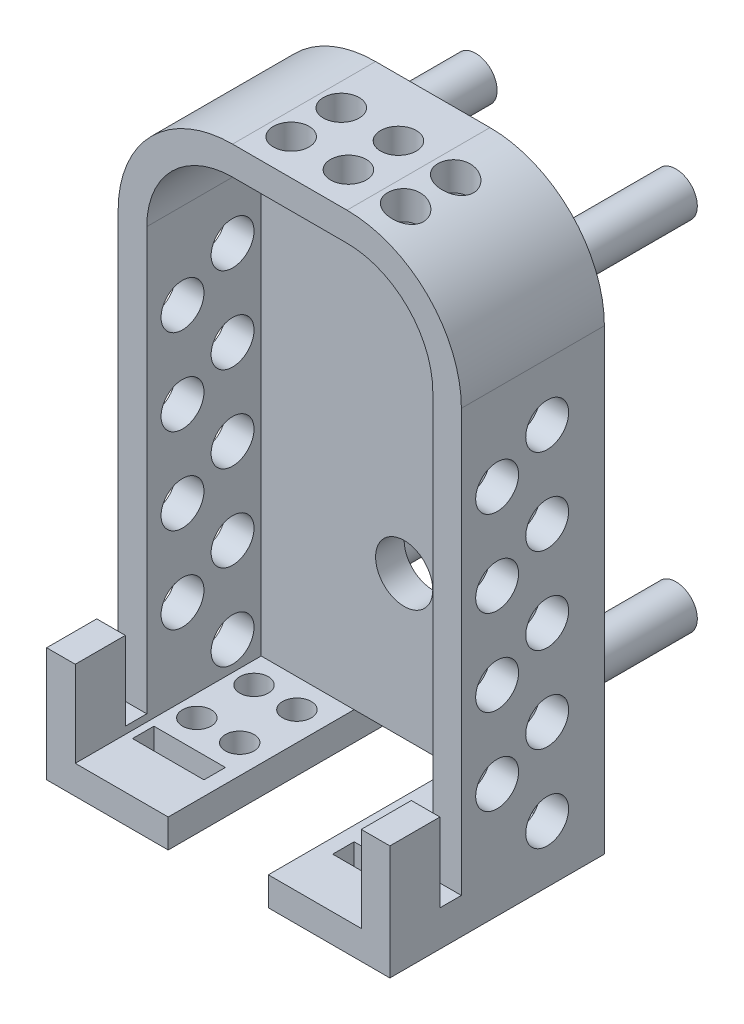
from build123d import *

# Parameters (mm, degrees)
ESQUISSE1_W             = 24
ESQUISSE1_H             = 40
BOSS_EXTRU_1_DEPTH      = 10
CONG_1_R                = 8
COQUE1_T                = -2
ESQUISSE2_W             = 7
ESQUISSE2_H             = 10
ENL_V_MAT_EXTRU_1_DEPTH = 2
ESQUISSE3_R             = 1.5
ENL_V_MAT_EXTRU_2_DEPTH = 33.802438934
ESQUISSE4_R             = 1.25
ENL_V_MAT_EXTRU_3_DEPTH = 13
ENL_V_MAT_EXTRU_4_REACH = 44.942
ESQUISSE5_R             = 1
BOSS_EXTRU_2_DEPTH      = 5
BOSS_EXTRU_2_DEPTH_BACK = 0.5
ENL_V_MAT_EXTRU_5_REACH = 36.655
ESQUISSE8_W             = 1.5
ESQUISSE8_H             = 5.5
ENL_V_MAT_EXTRU_6_REACH = 46.373
ESQUISSE9_W             = 5
ESQUISSE9_H             = 1.5
ENL_V_MAT_EXTRU_7_REACH = 28.702
ESQUISSE10_R            = 2
ESQUISSE11_R            = 1.5
BOSS_EXTRU_3_DEPTH      = 10


with BuildPart() as part:
    # Esquisse1 → Boss.-Extru.1 (new body)
    with BuildSketch(Plane.XY):
        Rectangle(ESQUISSE1_W, ESQUISSE1_H)
    extrude(amount=BOSS_EXTRU_1_DEPTH)

    # Congé1
    cong_1_edges = [part.edges().sort_by_distance(p)[0] for p in [
        (-12, 20, 5),
        (12, 20, 5),
    ]]
    fillet(cong_1_edges, radius=CONG_1_R)

    # Coque1
    coque1_openings = [part.faces().sort_by_distance(p)[0] for p in [
        (0, -0.536491662, 10),
    ]]
    offset(amount=COQUE1_T, openings=coque1_openings, kind=Kind.INTERSECTION)

    # Esquisse2 → Enlèv. mat.-Extru.1 (cut)
    with BuildSketch(Plane.XZ.offset(20)):
        with Locations((0, 5)):
            Rectangle(ESQUISSE2_W, ESQUISSE2_H)
    extrude(amount=-ENL_V_MAT_EXTRU_1_DEPTH, mode=Mode.SUBTRACT)

    # Esquisse3 → Enlèv. mat.-Extru.2 (cut, through all)
    with BuildSketch(Plane(origin=(12, 0, 0), x_dir=(0, 0, -1), z_dir=(1, 0, 0))):
        with Locations(Location((-4, -16, 0), (0, 0, 90))):
            Circle(ESQUISSE3_R)
        with Locations(Location((-7.5, -12, 0), (0, 0, 90))):
            Circle(ESQUISSE3_R)
        with Locations(Location((-7.5, -6, 0), (0, 0, 90))):
            Circle(ESQUISSE3_R)
        with Locations(Location((-4, -10, 0), (0, 0, 90))):
            Circle(ESQUISSE3_R)
        with Locations(Location((-7.5, 0, 0), (0, 0, 90))):
            Circle(ESQUISSE3_R)
        with Locations(Location((-4, -4, 0), (0, 0, 90))):
            Circle(ESQUISSE3_R)
        with Locations(Location((-7.5, 6, 0), (0, 0, 90))):
            Circle(ESQUISSE3_R)
        with Locations(Location((-4, 2, 0), (0, 0, 90))):
            Circle(ESQUISSE3_R)
        with Locations(Location((-4, 8, 0), (0, 0, 90))):
            Circle(ESQUISSE3_R)
    extrude(amount=-ENL_V_MAT_EXTRU_2_DEPTH, mode=Mode.SUBTRACT)

    # Esquisse4 → Enlèv. mat.-Extru.3 (cut)
    with BuildSketch(Plane(origin=(0, 20, 0), x_dir=(1, 0, 0), z_dir=(0, 1, 0))):
        with Locations(Location((-2.4, -4, 0), (0, 0, 270))):
            Circle(ESQUISSE4_R)
        with Locations(Location((1.6, -4, 0), (0, 0, 270))):
            Circle(ESQUISSE4_R)
        with Locations(Location((5.6, -4, 0), (0, 0, 270))):
            Circle(ESQUISSE4_R)
        with Locations(Location((1.6, -7.5, 0), (0, 0, 270))):
            Circle(ESQUISSE4_R)
        with Locations(Location((5.6, -7.5, 0), (0, 0, 270))):
            Circle(ESQUISSE4_R)
        with Locations(Location((-2.4, -7.5, 0), (0, 0, 270))):
            Circle(ESQUISSE4_R)
    extrude(amount=-ENL_V_MAT_EXTRU_3_DEPTH, mode=Mode.SUBTRACT)

    # Esquisse5 → Enlèv. mat.-Extru.4 (cut, up to next)
    with BuildSketch(Plane.XZ.offset(20), mode=Mode.PRIVATE) as enl_v_mat_extru_4_sk1:
        with Locations(Location((-8.5, 8, 0), (0, 0, 270))):
            Circle(ESQUISSE5_R)
    enl_v_mat_extru_4_tool1 = extrude(enl_v_mat_extru_4_sk1.sketch, amount=-ENL_V_MAT_EXTRU_4_REACH, mode=Mode.PRIVATE) & part.part
    # Esquisse5 → Enlèv. mat.-Extru.4 (cut, up to next)
    with BuildSketch(Plane.XZ.offset(20), mode=Mode.PRIVATE) as enl_v_mat_extru_4_sk2:
        with Locations(Location((-5.5, 8, 0), (0, 0, 270))):
            Circle(ESQUISSE5_R)
    enl_v_mat_extru_4_tool2 = extrude(enl_v_mat_extru_4_sk2.sketch, amount=-ENL_V_MAT_EXTRU_4_REACH, mode=Mode.PRIVATE) & part.part
    # Esquisse5 → Enlèv. mat.-Extru.4 (cut, up to next)
    with BuildSketch(Plane.XZ.offset(20), mode=Mode.PRIVATE) as enl_v_mat_extru_4_sk3:
        with Locations(Location((-5.5, 4, 0), (0, 0, 270))):
            Circle(ESQUISSE5_R)
    enl_v_mat_extru_4_tool3 = extrude(enl_v_mat_extru_4_sk3.sketch, amount=-ENL_V_MAT_EXTRU_4_REACH, mode=Mode.PRIVATE) & part.part
    # Esquisse5 → Enlèv. mat.-Extru.4 (cut, up to next)
    with BuildSketch(Plane.XZ.offset(20), mode=Mode.PRIVATE) as enl_v_mat_extru_4_sk4:
        with Locations(Location((-8.5, 4, 0), (0, 0, 270))):
            Circle(ESQUISSE5_R)
    enl_v_mat_extru_4_tool4 = extrude(enl_v_mat_extru_4_sk4.sketch, amount=-ENL_V_MAT_EXTRU_4_REACH, mode=Mode.PRIVATE) & part.part
    # Esquisse5 → Enlèv. mat.-Extru.4 (cut, up to next)
    with BuildSketch(Plane.XZ.offset(20), mode=Mode.PRIVATE) as enl_v_mat_extru_4_sk5:
        with Locations(Location((8.5, 4, 0), (0, 0, 90))):
            Circle(ESQUISSE5_R)
    enl_v_mat_extru_4_tool5 = extrude(enl_v_mat_extru_4_sk5.sketch, amount=-ENL_V_MAT_EXTRU_4_REACH, mode=Mode.PRIVATE) & part.part
    # Esquisse5 → Enlèv. mat.-Extru.4 (cut, up to next)
    with BuildSketch(Plane.XZ.offset(20), mode=Mode.PRIVATE) as enl_v_mat_extru_4_sk6:
        with Locations(Location((5.5, 4, 0), (0, 0, 90))):
            Circle(ESQUISSE5_R)
    enl_v_mat_extru_4_tool6 = extrude(enl_v_mat_extru_4_sk6.sketch, amount=-ENL_V_MAT_EXTRU_4_REACH, mode=Mode.PRIVATE) & part.part
    # Esquisse5 → Enlèv. mat.-Extru.4 (cut, up to next)
    with BuildSketch(Plane.XZ.offset(20), mode=Mode.PRIVATE) as enl_v_mat_extru_4_sk7:
        with Locations(Location((5.5, 8, 0), (0, 0, 90))):
            Circle(ESQUISSE5_R)
    enl_v_mat_extru_4_tool7 = extrude(enl_v_mat_extru_4_sk7.sketch, amount=-ENL_V_MAT_EXTRU_4_REACH, mode=Mode.PRIVATE) & part.part
    # Esquisse5 → Enlèv. mat.-Extru.4 (cut, up to next)
    with BuildSketch(Plane.XZ.offset(20), mode=Mode.PRIVATE) as enl_v_mat_extru_4_sk8:
        with Locations(Location((8.5, 8, 0), (0, 0, 90))):
            Circle(ESQUISSE5_R)
    enl_v_mat_extru_4_tool8 = extrude(enl_v_mat_extru_4_sk8.sketch, amount=-ENL_V_MAT_EXTRU_4_REACH, mode=Mode.PRIVATE) & part.part
    add(enl_v_mat_extru_4_tool1.solids().sort_by_distance((-8.5, -20, 8))[0], mode=Mode.SUBTRACT)
    add(enl_v_mat_extru_4_tool2.solids().sort_by_distance((-5.5, -20, 8))[0], mode=Mode.SUBTRACT)
    add(enl_v_mat_extru_4_tool3.solids().sort_by_distance((-5.5, -20, 4))[0], mode=Mode.SUBTRACT)
    add(enl_v_mat_extru_4_tool4.solids().sort_by_distance((-8.5, -20, 4))[0], mode=Mode.SUBTRACT)
    add(enl_v_mat_extru_4_tool5.solids().sort_by_distance((8.5, -20, 4))[0], mode=Mode.SUBTRACT)
    add(enl_v_mat_extru_4_tool6.solids().sort_by_distance((5.5, -20, 4))[0], mode=Mode.SUBTRACT)
    add(enl_v_mat_extru_4_tool7.solids().sort_by_distance((5.5, -20, 8))[0], mode=Mode.SUBTRACT)
    add(enl_v_mat_extru_4_tool8.solids().sort_by_distance((8.5, -20, 8))[0], mode=Mode.SUBTRACT)

    # Esquisse7 → Boss.-Extru.2 (add, two sides: drawn at the far end of the back side and taken through both)
    with BuildSketch(Plane.XY.offset(10).offset(-BOSS_EXTRU_2_DEPTH_BACK)):
        Polygon((-12, -12), (-12, -20), (-3.5, -20), (-3.5, -18), (-10, -18), (-10, -12), align=None)
        Polygon((12, -12), (12, -20), (3.5, -20), (3.5, -18), (10, -18), (10, -12), align=None)
    extrude(amount=BOSS_EXTRU_2_DEPTH + BOSS_EXTRU_2_DEPTH_BACK)

    # Esquisse8 → Enlèv. mat.-Extru.5 (cut, up to next)
    with BuildSketch(Plane(origin=(12, 0, 0), x_dir=(0, 0, -1), z_dir=(1, 0, 0)), mode=Mode.PRIVATE) as enl_v_mat_extru_5_sk1:
        with Locations((-10.75, -14.75)):
            Rectangle(ESQUISSE8_W, ESQUISSE8_H)
    enl_v_mat_extru_5_tool1 = extrude(enl_v_mat_extru_5_sk1.sketch, amount=-ENL_V_MAT_EXTRU_5_REACH, mode=Mode.PRIVATE) & part.part
    enl_v_mat_extru_5 = enl_v_mat_extru_5_tool1.solids().sort_by_distance((12, -14.75, 10.75))[0]
    add(enl_v_mat_extru_5, mode=Mode.SUBTRACT)

    # Esquisse9 → Enlèv. mat.-Extru.6 (cut, up to next)
    with BuildSketch(Plane.XZ.offset(20), mode=Mode.PRIVATE) as enl_v_mat_extru_6_sk1:
        with Locations((7, 10.75)):
            Rectangle(ESQUISSE9_W, ESQUISSE9_H)
    enl_v_mat_extru_6_tool1 = extrude(enl_v_mat_extru_6_sk1.sketch, amount=-ENL_V_MAT_EXTRU_6_REACH, mode=Mode.PRIVATE) & part.part
    enl_v_mat_extru_6 = enl_v_mat_extru_6_tool1.solids().sort_by_distance((7, -20, 10.75))[0]
    add(enl_v_mat_extru_6, mode=Mode.SUBTRACT)

    # Symétrie1: Enlèv. mat.-Extru.5, Enlèv. mat.-Extru.6 across plane
    add(enl_v_mat_extru_5.mirror(Plane(origin=(0, 0, 0), x_dir=(0, 0, 1), z_dir=(1, 0, 0))), mode=Mode.SUBTRACT)
    add(enl_v_mat_extru_6.mirror(Plane(origin=(0, 0, 0), x_dir=(0, 0, 1), z_dir=(1, 0, 0))), mode=Mode.SUBTRACT)

    # Esquisse10 → Enlèv. mat.-Extru.7 (cut, up to next)
    with BuildSketch(Plane.XY.offset(2), mode=Mode.PRIVATE) as enl_v_mat_extru_7_sk1:
        with Locations((0, -8)):
            Circle(ESQUISSE10_R)
    enl_v_mat_extru_7_tool1 = extrude(enl_v_mat_extru_7_sk1.sketch, amount=-ENL_V_MAT_EXTRU_7_REACH, mode=Mode.PRIVATE) & part.part
    add(enl_v_mat_extru_7_tool1.solids().sort_by_distance((0, -8, 2))[0], mode=Mode.SUBTRACT)

    # Esquisse11 → Boss.-Extru.3 (add)
    with BuildSketch(Plane(origin=(0, 0, 0), x_dir=(-1, 0, 0), z_dir=(0, 0, -1))):
        with Locations(Location((-7, 12.5, 0), (0, 0, 180))):
            Circle(ESQUISSE11_R)
        with Locations(Location((7, 12.5, 0), (0, 0, 180))):
            Circle(ESQUISSE11_R)
        with Locations(Location((-7, -12.5, 0), (0, 0, 180))):
            Circle(ESQUISSE11_R)
        with Locations(Location((7, -12.5, 0), (0, 0, 180))):
            Circle(ESQUISSE11_R)
    extrude(amount=BOSS_EXTRU_3_DEPTH)


solid = part.part
